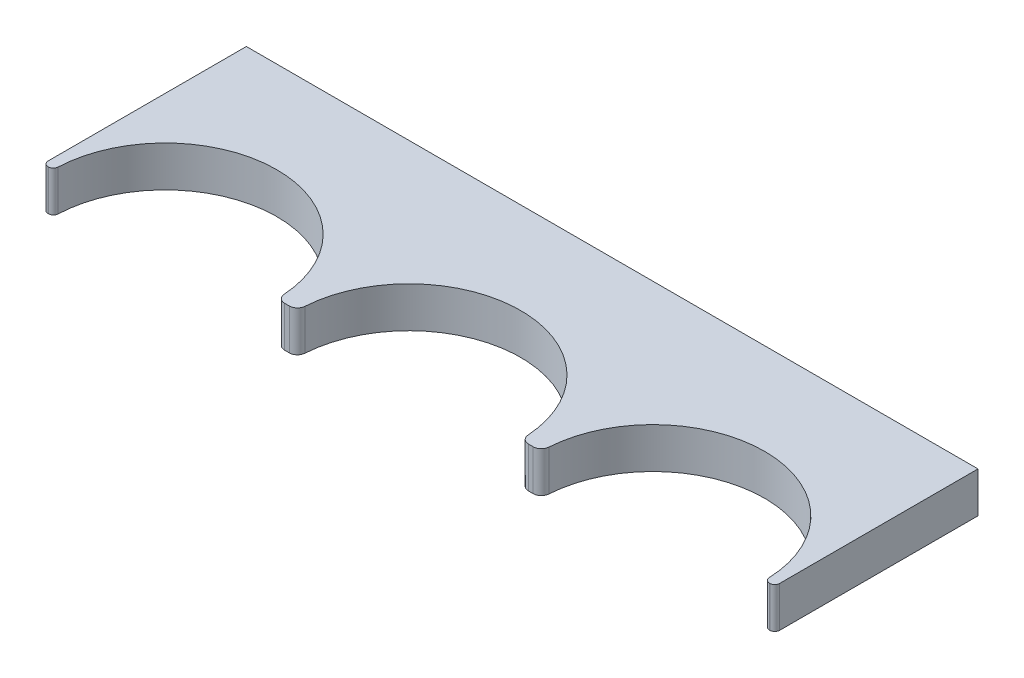
from build123d import *

# Parameters (mm, degrees)
BOSS_EXTRU_1_DEPTH = 10


with BuildPart() as part:
    # Esquisse1 → Boss.-Extru.1 (new body)
    with BuildSketch(Plane(origin=(0, 0, 0), x_dir=(1, 0, 0), z_dir=(0, 1, 0))):
        with BuildLine():
            Line((-88.674901918, -25), (-88.8, -25))
            ThreePointArc((-88.8, -25), (-89.648528137, -24.648528137), (-90, -23.8))
            Line((-90, -23.8), (-90, 25))
            Line((-90, 25), (90, 25))
            Line((90, 25), (90, -23.8))
            ThreePointArc((90, -23.8), (89.648528137, -24.648528137), (88.8, -25))
            Line((88.8, -25), (88.674901918, -25))
            ThreePointArc((88.674901918, -25), (87.844302453, -24.666085752), (87.475951315, -23.850174216))
            ThreePointArc((87.475951315, -23.850174216), (60.357828362, 2.497671881), (32.56327302, -23.13559322))
            ThreePointArc((32.56327302, -23.13559322), (31.933307512, -24.461366901), (30.567874694, -25))
            Line((30.567874694, -25), (29.432125306, -25))
            ThreePointArc((29.432125306, -25), (28.066692488, -24.461366901), (27.43672698, -23.13559322))
            ThreePointArc((27.43672698, -23.13559322), (0, 2.5), (-27.43672698, -23.13559322))
            ThreePointArc((-27.43672698, -23.13559322), (-28.066692488, -24.461366901), (-29.432125306, -25))
            Line((-29.432125306, -25), (-30.567874694, -25))
            ThreePointArc((-30.567874694, -25), (-31.933307512, -24.461366901), (-32.56327302, -23.13559322))
            ThreePointArc((-32.56327302, -23.13559322), (-60.357828362, 2.497671881), (-87.475951315, -23.850174216))
            ThreePointArc((-87.475951315, -23.850174216), (-87.844302453, -24.666085752), (-88.674901918, -25))
        make_face()
    extrude(amount=BOSS_EXTRU_1_DEPTH)


solid = part.part
